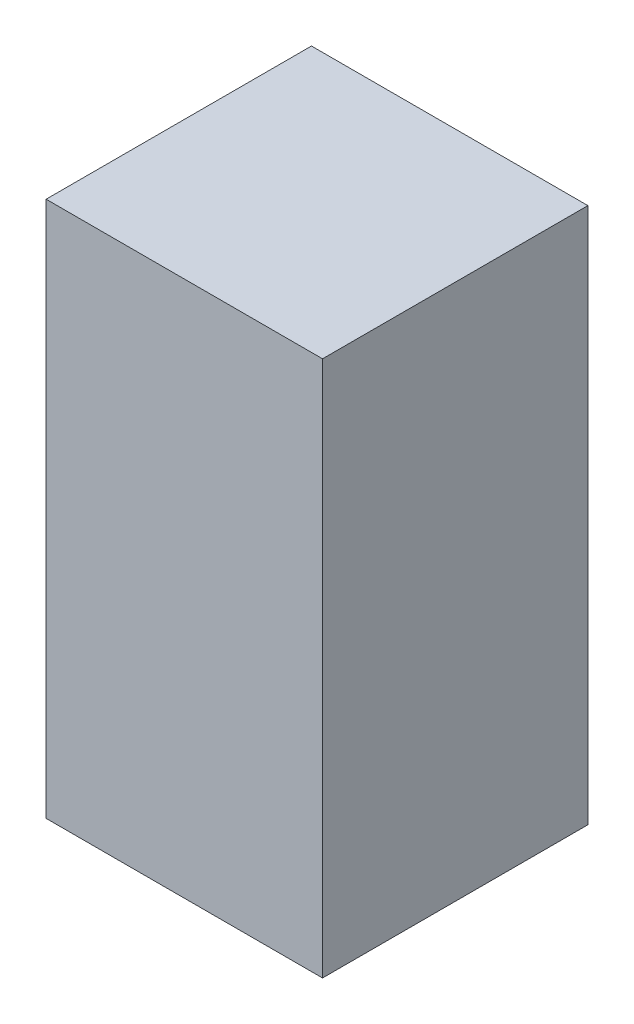
from build123d import *

# Parameters (mm, degrees)
SKETCH1_W           = 1270
SKETCH1_H           = 2463.8
BOSS_EXTRUDE1_DEPTH = 1219.2


with BuildPart() as part:
    # Sketch1 → Boss-Extrude1 (new body)
    with BuildSketch(Plane.XY):
        with Locations((635, 1231.9)):
            Rectangle(SKETCH1_W, SKETCH1_H)
    extrude(amount=BOSS_EXTRUDE1_DEPTH)


solid = part.part
